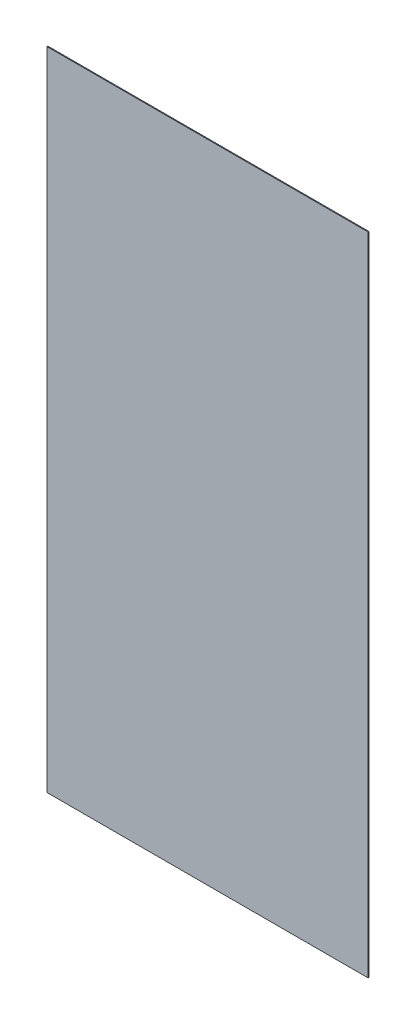
from build123d import *

# Parameters (mm, degrees)
SKETCH1_W           = 603.25
SKETCH1_H           = 1212.85
BOSS_EXTRUDE1_DEPTH = 1.651


with BuildPart() as part:
    # Sketch1 → Boss-Extrude1 (new body)
    with BuildSketch(Plane.XY):
        with Locations((301.625, 606.425)):
            Rectangle(SKETCH1_W, SKETCH1_H)
    extrude(amount=BOSS_EXTRUDE1_DEPTH)


solid = part.part
